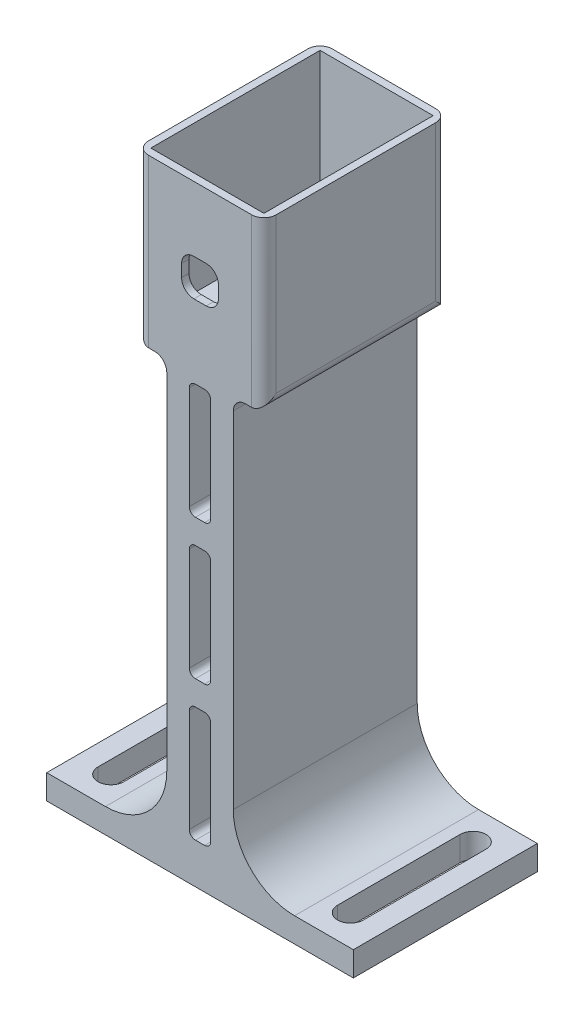
from build123d import *

# Parameters (mm, degrees)
CROQUIS1_W              = 20.84578855
CROQUIS1_H              = 73.5
SALIENTE_EXTRUIR1_DEPTH = 30
CROQUIS2_W              = 20.84578855
CROQUIS2_H              = 30
CROQUIS2_W_2            = 18
CROQUIS2_H_2            = 2
SALIENTE_EXTRUIR2_DEPTH = 2
CROQUIS3_W              = 20.84578855
CROQUIS3_H              = 30
CROQUIS3_W_2            = 18.44578855
CROQUIS3_H_2            = 27.6
SALIENTE_EXTRUIR3_DEPTH = 24
CORTAR_EXTRUIR1_DEPTH   = 12
CROQUIS6_W              = 10
CROQUIS6_H              = 2.1
CORTAR_EXTRUIR2_DEPTH   = 12
CROQUIS7_W              = 5
CROQUIS7_H              = 72.3
CORTAR_EXTRUIR3_DEPTH   = 81
REDONDEO1_R             = 2
SALIENTE_EXTRUIR4_DEPTH = 30
CORTAR_EXTRUIR4_DEPTH   = 30
CROQUIS11_W             = 3.5
CROQUIS11_H             = 18.8
CORTAR_EXTRUIR5_DEPTH   = 30
REDONDEO2_R             = 1


with BuildPart() as part:
    # Croquis1 → Saliente-Extruir1 (new body)
    with BuildSketch(Plane.XY):
        with Locations((4.194544399, -18.730645161)):
            Rectangle(CROQUIS1_W, CROQUIS1_H)
    extrude(amount=-SALIENTE_EXTRUIR1_DEPTH)

    # Croquis2 → Saliente-Extruir2 (add)
    with BuildSketch(Plane(origin=(0, 18.019354839, 0), x_dir=(1, 0, 0), z_dir=(0, 1, 0))):
        with Locations((4.194544399, 15)):
            Rectangle(CROQUIS2_W, CROQUIS2_H)
        with Locations((4.194544399, 6)):
            Rectangle(CROQUIS2_W_2, CROQUIS2_H_2, mode=Mode.SUBTRACT)
    extrude(amount=SALIENTE_EXTRUIR2_DEPTH)

    # Croquis3 → Saliente-Extruir3 (add)
    with BuildSketch(Plane(origin=(0, 20.019354839, 0), x_dir=(1, 0, 0), z_dir=(0, 1, 0))):
        with Locations((4.194544399, 15)):
            Rectangle(CROQUIS3_W, CROQUIS3_H)
        with Locations((4.194544399, 15)):
            Rectangle(CROQUIS3_W_2, CROQUIS3_H_2, mode=Mode.SUBTRACT)
    extrude(amount=SALIENTE_EXTRUIR3_DEPTH)

    # Croquis4 → Cortar-Extruir1 (cut)
    with BuildSketch(Plane.XY):
        with BuildLine():
            Line((3.194544399, 33.436155454), (5.194544399, 33.436155454))
            ThreePointArc((5.194544399, 33.436155454), (6.608757961, 32.850369016), (7.194544399, 31.436155454))
            Line((7.194544399, 31.436155454), (7.194544399, 29.436155454))
            ThreePointArc((7.194544399, 29.436155454), (6.608757961, 28.021941892), (5.194544399, 27.436155454))
            Line((5.194544399, 27.436155454), (3.194544399, 27.436155454))
            ThreePointArc((3.194544399, 27.436155454), (1.780330837, 28.021941892), (1.194544399, 29.436155454))
            Line((1.194544399, 29.436155454), (1.194544399, 31.436155454))
            ThreePointArc((1.194544399, 31.436155454), (1.780330837, 32.850369016), (3.194544399, 33.436155454))
        make_face()
    extrude(amount=-CORTAR_EXTRUIR1_DEPTH, mode=Mode.SUBTRACT)

    # Croquis6 → Cortar-Extruir2 (cut)
    with BuildSketch(Plane.XY.offset(-28.8)):
        with Locations((4.194544399, 21.069354839)):
            Rectangle(CROQUIS6_W, CROQUIS6_H)
    extrude(amount=-CORTAR_EXTRUIR2_DEPTH, mode=Mode.SUBTRACT)

    # Croquis7 → Cortar-Extruir3 (cut)
    with BuildSketch(Plane.XY):
        with Locations((-3.728349876, -19.330645161)):
            Rectangle(CROQUIS7_W, CROQUIS7_H)
        with Locations((12.117438674, -19.330645161)):
            Rectangle(CROQUIS7_W, CROQUIS7_H)
    extrude(amount=-CORTAR_EXTRUIR3_DEPTH, mode=Mode.SUBTRACT)

    # Redondeo1
    redondeo1_edges = [part.edges().sort_by_distance(p)[0] for p in [
        (-6.228349876, 16.819354839, -15),
        (-1.228349876, 16.819354839, -15),
        (14.617438674, 16.819354839, -15),
        (9.617438674, 16.819354839, -15),
        (-6.228349876, 30.419354839, -30),
        (14.617438674, 30.419354839, -30),
        (-6.228349876, 30.419354839, 0),
        (14.617438674, 30.419354839, 0),
    ]]
    fillet(redondeo1_edges, radius=REDONDEO1_R)

    # Croquis9 → Saliente-Extruir4 (add)
    with BuildSketch(Plane.XY):
        with BuildLine():
            Line((-20.805455601, -55.480645161), (29.194544399, -55.480645161))
            Line((29.194544399, -55.480645161), (29.194544399, -51.480645161))
            Line((29.194544399, -51.480645161), (19.617438674, -51.480645161))
            ThreePointArc((19.617438674, -51.480645161), (12.546370862, -48.551712973), (9.617438674, -41.480645161))
            Line((9.617438674, -41.480645161), (9.617438674, -20.330645161))
            Line((9.617438674, -20.330645161), (-1.228349876, -20.330645161))
            Line((-1.228349876, -20.330645161), (-1.228349876, -41.480645161))
            ThreePointArc((-1.228349876, -41.480645161), (-4.157282064, -48.551712973), (-11.228349876, -51.480645161))
            Line((-11.228349876, -51.480645161), (-20.805455601, -51.480645161))
            Line((-20.805455601, -51.480645161), (-20.805455601, -55.480645161))
        make_face()
    extrude(amount=-SALIENTE_EXTRUIR4_DEPTH)

    # Croquis10 → Cortar-Extruir4 (cut)
    with BuildSketch(Plane(origin=(0, -51.480645161, 0), x_dir=(1, 0, 0), z_dir=(0, 1, 0))):
        with BuildLine():
            Line((25.824740978, 25), (25.824740978, 5))
            ThreePointArc((25.824740978, 5), (23.724740978, 2.9), (21.624740978, 5))
            Line((21.624740978, 5), (21.624740978, 25))
            ThreePointArc((21.624740978, 25), (23.724740978, 27.1), (25.824740978, 25))
        make_face()
        with BuildLine():
            Line((-17.43565218, 25), (-17.43565218, 5))
            ThreePointArc((-17.43565218, 5), (-15.33565218, 2.9), (-13.23565218, 5))
            Line((-13.23565218, 5), (-13.23565218, 25))
            ThreePointArc((-13.23565218, 25), (-15.33565218, 27.1), (-17.43565218, 25))
        make_face()
    extrude(amount=-CORTAR_EXTRUIR4_DEPTH, mode=Mode.SUBTRACT)

    # Croquis11 → Cortar-Extruir5 (cut)
    with BuildSketch(Plane.XY):
        with Locations((4.194544399, 6.119354839)):
            Rectangle(CROQUIS11_W, CROQUIS11_H)
        with Locations((4.194544399, -16.680645161)):
            Rectangle(CROQUIS11_W, CROQUIS11_H)
        with Locations((4.194544399, -39.480645161)):
            Rectangle(CROQUIS11_W, CROQUIS11_H)
    extrude(amount=-CORTAR_EXTRUIR5_DEPTH, mode=Mode.SUBTRACT)

    # Redondeo2
    redondeo2_edges = [part.edges().sort_by_distance(p)[0] for p in [
        (2.444544399, -3.280645161, -15),
        (2.444544399, 15.519354839, -15),
        (5.944544399, 15.519354839, -15),
        (5.944544399, -3.280645161, -15),
        (2.444544399, -26.080645161, -15),
        (2.444544399, -7.280645161, -15),
        (5.944544399, -7.280645161, -15),
        (5.944544399, -26.080645161, -15),
        (2.444544399, -48.880645161, -15),
        (2.444544399, -30.080645161, -15),
        (5.944544399, -30.080645161, -15),
        (5.944544399, -48.880645161, -15),
    ]]
    fillet(redondeo2_edges, radius=REDONDEO2_R)


solid = part.part
